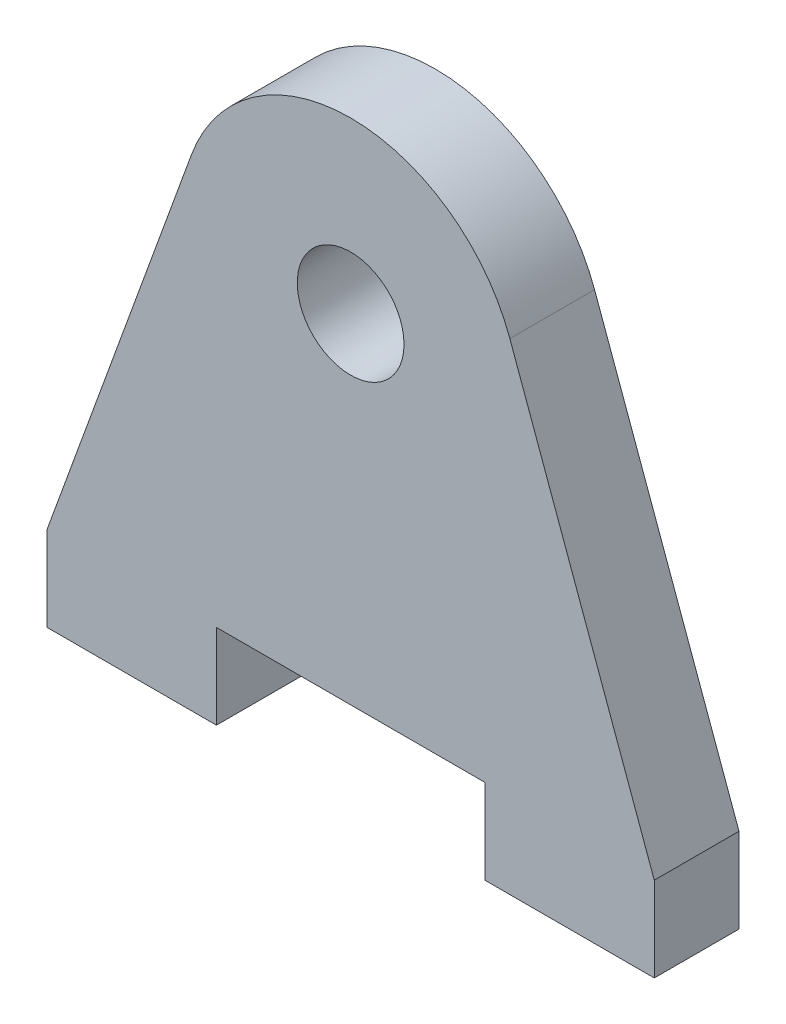
from build123d import *

# Parameters (mm, degrees)
SKETCH2_W           = 12.7
SKETCH2_H           = 6.35
SKETCH2_R           = 4
BOSS_EXTRUDE1_DEPTH = 6.35


with BuildPart() as part:
    # Sketch2 → Boss-Extrude1 (new body)
    # profile 1 of 3: a face of its own
    with BuildSketch(Plane.XY):
        with Locations((-16.409901661, -28.575)):
            Rectangle(SKETCH2_W, SKETCH2_H)
    # profile 2 of 3: a face of its own
    with BuildSketch(Plane.XY):
        with BuildLine():
            Line((22.759901661, -25.4), (11.934096284, 4.34365582))
            ThreePointArc((11.934096284, 4.34365582), (0, 12.7), (-11.934096284, 4.34365582))
            Line((-11.934096284, 4.34365582), (-22.759901661, -25.4))
            Line((-22.759901661, -25.4), (22.759901661, -25.4))
        make_face()
        Circle(SKETCH2_R, mode=Mode.SUBTRACT)
    # profile 3 of 3: a face of its own
    with BuildSketch(Plane.XY):
        with Locations((16.409901661, -28.575)):
            Rectangle(SKETCH2_W, SKETCH2_H)
    extrude(amount=BOSS_EXTRUDE1_DEPTH)


solid = part.part
